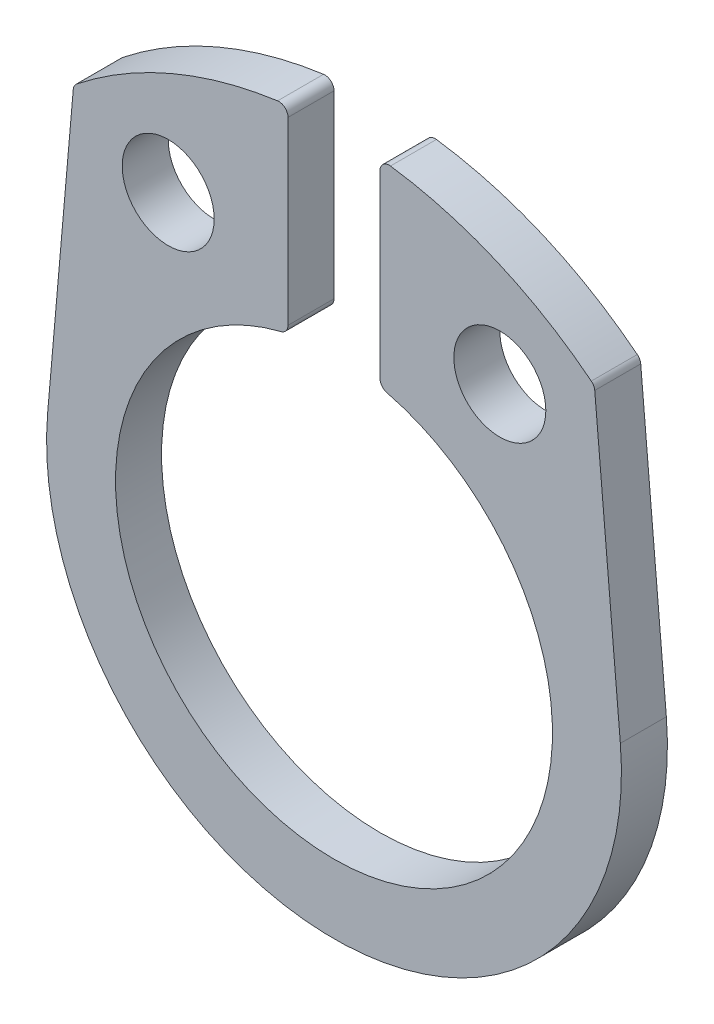
from build123d import *

# Parameters (mm, degrees)
BOSS_EXTRUDE1_DEPTH = 0.5
SKETCH2_R           = 1
CUT_EXTRUDE1_DEPTH  = 11.9573035
FILLET1_R           = 0.2


with BuildPart() as part:
    # Sketch1 → Boss-Extrude1 (new, symmetric)
    with BuildSketch(Plane.XY):
        with BuildLine():
            Line((-5.661803514, 6.995997497), (-6.226216863, 0.544723392))
            ThreePointArc((-6.226216863, 0.544723392), (0, -6.25), (6.226216863, 0.544723392))
            Line((6.226216863, 0.544723392), (5.661803514, 6.995997497))
            ThreePointArc((5.661803514, 6.995997497), (3.470425019, 8.303983995), (1, 8.94427191))
            Line((1, 8.94427191), (1, 4.643543905))
            ThreePointArc((1, 4.643543905), (0, -4.75), (-1, 4.643543905))
            Line((-1, 4.643543905), (-1, 8.94427191))
            ThreePointArc((-1, 8.94427191), (-3.470425019, 8.303983995), (-5.661803514, 6.995997497))
        make_face()
    extrude(amount=BOSS_EXTRUDE1_DEPTH, both=True)

    # Sketch2 → Cut-Extrude1 (cut, through all)
    with BuildSketch(Plane.XY.offset(0.5)):
        with Locations((-3.605551275, 6)):
            Circle(SKETCH2_R)
        with Locations((3.605551275, 6)):
            Circle(SKETCH2_R)
    extrude(amount=-CUT_EXTRUDE1_DEPTH, mode=Mode.SUBTRACT)

    # Fillet1
    fillet1_edges = [part.edges().sort_by_distance(p)[0] for p in [
        (5.661803514, 6.995997497, 0),
        (-5.661803514, 6.995997497, 0),
        (-1, 8.94427191, 0),
        (-1, 4.643543905, 0),
        (1, 4.643543905, 0),
        (1, 8.94427191, 0),
    ]]
    fillet(fillet1_edges, radius=FILLET1_R)


solid = part.part
